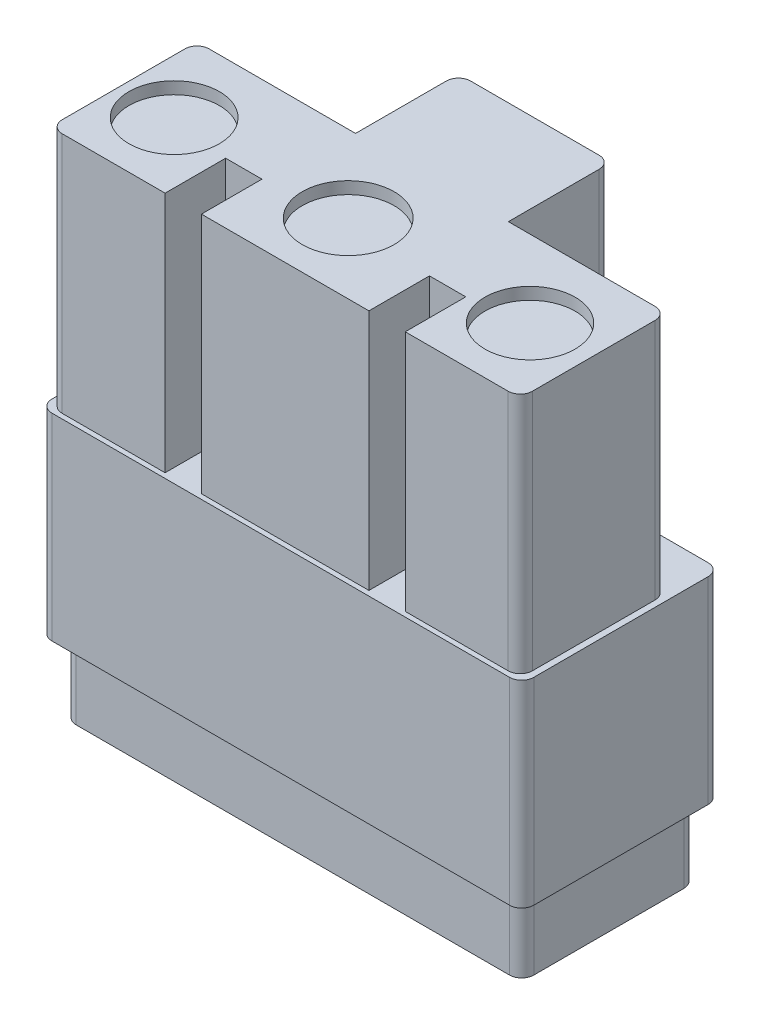
from build123d import *

# Parameters (mm, degrees)
SKETCH_1_W          = 39.8
SKETCH_1_H          = 16.4
EXTRUDE_1_DEPTH     = 16.3
SKETCH_2_W          = 37.8
SKETCH_2_H          = 14.4
EXTRUDE_2_DEPTH     = 6
SKETCH_3_W          = 38.834721862
SKETCH_3_H          = 12.135850582
EXTRUDE_3_DEPTH     = 20
SKETCH_4_W          = 12.623118615
SKETCH_4_H          = 42.3
EXTRUDE_4_DEPTH     = 8.5
SKETCH_5_W          = 3
SKETCH_5_H          = 20
CUT_EXTRUDE_2_DEPTH = 5
SKETCH_6_R          = 3.734555691
SKETCH_6_R_2        = 3.793211722
SKETCH_6_R_3        = 3.72240449
CUT_EXTRUDE_3_DEPTH = 1
SKETCH_7_R          = 3.906226906
SKETCH_7_R_2        = 3.81532866
SKETCH_7_R_3        = 3.686295828
CUT_EXTRUDE_4_DEPTH = 1
FILLET_1_R          = 1


with BuildPart() as part:
    # ｽｹｯﾁ1 → ﾎﾞｽ - 押し出し1 (new body)
    with BuildSketch(Plane(origin=(0, 0, 0), x_dir=(1, 0, 0), z_dir=(0, 1, 0))):
        with Locations((19.9, 8.2)):
            Rectangle(SKETCH_1_W, SKETCH_1_H)
    extrude(amount=EXTRUDE_1_DEPTH)

    # ｽｹｯﾁ2 → ﾎﾞｽ - 押し出し2 (add)
    with BuildSketch(Plane.XZ):
        with Locations((19.9, -8.2)):
            Rectangle(SKETCH_2_W, SKETCH_2_H)
    extrude(amount=EXTRUDE_2_DEPTH)

    # ｽｹｯﾁ3 → ﾎﾞｽ - 押し出し3 (add)
    with BuildSketch(Plane(origin=(0, 16.3, 0), x_dir=(1, 0, 0), z_dir=(0, 1, 0))):
        with Locations((19.862075467, 6.474433745)):
            Rectangle(SKETCH_3_W, SKETCH_3_H)
    extrude(amount=EXTRUDE_3_DEPTH)

    # ｽｹｯﾁ4 → ﾎﾞｽ - 押し出し4 (add)
    with BuildSketch(Plane(origin=(0, 0, -12.542359036), x_dir=(-1, 0, 0), z_dir=(0, 0, -1))):
        with Locations((-19.847838353, 15.15)):
            Rectangle(SKETCH_4_W, SKETCH_4_H)
    extrude(amount=EXTRUDE_4_DEPTH)

    # ｽｹｯﾁ5 → ｶｯﾄ - 押し出し2 (cut)
    with BuildSketch(Plane.XY.offset(-0.406508454)):
        with Locations((11.444714536, 26.3)):
            Rectangle(SKETCH_5_W, SKETCH_5_H)
        with Locations((28.279436398, 26.3)):
            Rectangle(SKETCH_5_W, SKETCH_5_H)
    extrude(amount=-CUT_EXTRUDE_2_DEPTH, mode=Mode.SUBTRACT)

    # ｽｹｯﾁ6 → ｶｯﾄ - 押し出し3 (cut)
    with BuildSketch(Plane(origin=(0, 36.3, 0), x_dir=(1, 0, 0), z_dir=(0, 1, 0))):
        with Locations(Location((4.919809438, 6.178820482, 0), (0, 0, 270))):
            Circle(SKETCH_6_R)
        with Locations(Location((19.293207471, 6.178820482, 0), (0, 0, 270))):
            Circle(SKETCH_6_R_2)
        with Locations(Location((34.311322566, 6.178820482, 0), (0, 0, 270))):
            Circle(SKETCH_6_R_3)
    extrude(amount=-CUT_EXTRUDE_3_DEPTH, mode=Mode.SUBTRACT)

    # ｽｹｯﾁ7 → ｶｯﾄ - 押し出し4 (cut)
    with BuildSketch(Plane.XZ.offset(6)):
        with Locations(Location((6.891885157, -8.075047135, 0), (0, 0, 270))):
            Circle(SKETCH_7_R)
        with Locations(Location((19.065660272, -8.075047135, 0), (0, 0, 270))):
            Circle(SKETCH_7_R_2)
        with Locations(Location((32.187548714, -8.075047135, 0), (0, 0, 270))):
            Circle(SKETCH_7_R_3)
    extrude(amount=-CUT_EXTRUDE_4_DEPTH, mode=Mode.SUBTRACT)

    # ﾌｨﾚｯﾄ1
    fillet_1_edges = [part.edges().sort_by_distance(p)[0] for p in [
        (38.8, -3, -1),
        (1, -3, -1),
        (1, -3, -15.4),
        (38.8, -3, -15.4),
        (0.444714536, 26.3, -12.542359036),
        (0.444714536, 26.3, -0.406508454),
        (39.279436398, 26.3, -0.406508454),
        (39.279436398, 26.3, -12.542359036),
        (26.15939766, 15.15, -21.042359036),
        (13.536279045, 15.15, -21.042359036),
        (0, 8.15, -16.4),
        (39.8, 8.15, -16.4),
        (39.8, 8.15, 0),
        (0, 8.15, 0),
    ]]
    fillet(fillet_1_edges, radius=FILLET_1_R)


solid = part.part
